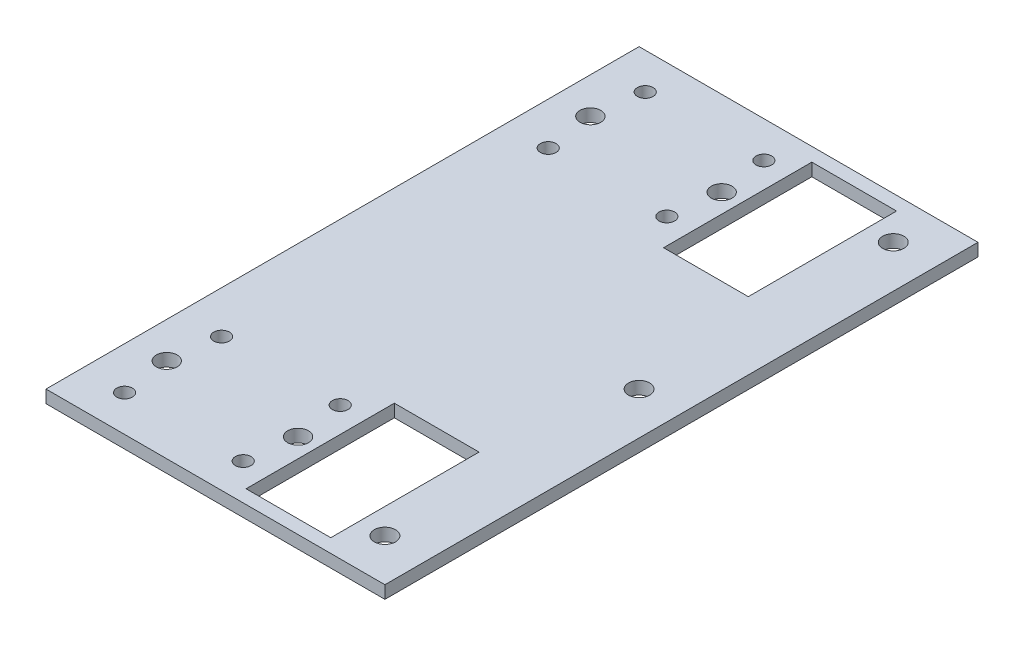
from build123d import *

# Parameters (mm, degrees)
SKETCH_1_R          = 2.5
SKETCH_1_R_2        = 2.45
SKETCH_1_R_3        = 1.85
SKETCH_1_W          = 48
SKETCH_1_H          = 40
EXTRUDE_1_DEPTH     = 3
SKETCH_2_W          = 20
SKETCH_2_H          = 35
CUT_EXTRUDE_1_DEPTH = 10


with BuildPart() as part:
    # 草图1 → 凸台-拉伸1 (new body)
    # profile 1 of 5: a face of its own
    with BuildSketch(Plane(origin=(0, 0, 0), x_dir=(1, 0, 0), z_dir=(0, 1, 0))):
        with BuildLine():
            Line((8, -30), (8, -70))
            Line((8, -70), (40, -70))
            Line((40, -70), (40, 60))
            Line((40, 60), (32.5, 60))
            ThreePointArc((32.5, 60), (28.232233047, 58.232233047), (30, 62.5))
            Line((30, 62.5), (30, 70))
            Line((30, 70), (8, 70))
            Line((8, 70), (8, 30))
            Line((8, 30), (-40, 30))
            Line((-40, 30), (-40, -30))
            Line((-40, -30), (8, -30))
        make_face()
        with Locations(Location((30, -60, 0), (0, 0, 270))):
            Circle(SKETCH_1_R, mode=Mode.SUBTRACT)
        with Locations(Location((30, 0, 0), (0, 0, 270))):
            Circle(SKETCH_1_R, mode=Mode.SUBTRACT)
    # profile 2 of 5: a face of its own
    with BuildSketch(Plane(origin=(0, 0, 0), x_dir=(1, 0, 0), z_dir=(0, 1, 0))):
        with BuildLine():
            Line((32.5, 60), (40, 60))
            Line((40, 60), (40, 70))
            Line((40, 70), (30, 70))
            Line((30, 70), (30, 62.5))
            ThreePointArc((30, 62.5), (31.767766953, 61.767766953), (32.5, 60))
        make_face()
    # profile 3 of 5: a face of its own
    with BuildSketch(Plane(origin=(0, 0, 0), x_dir=(1, 0, 0), z_dir=(0, 1, 0))):
        with BuildLine():
            Line((-40, 61.45), (-40, 30))
            Line((-40, 30), (8, 30))
            Line((8, 30), (8, 70))
            Line((8, 70), (-30, 70))
            Line((-30, 70), (-30, 63.3))
            ThreePointArc((-30, 63.3), (-28.691852455, 62.758147545), (-28.15, 61.45))
            ThreePointArc((-28.15, 61.45), (-30, 59.6), (-31.85, 61.45))
            Line((-31.85, 61.45), (-40, 61.45))
        make_face()
        with Locations(Location((-31.5, 50, 0), (0, 0, 270))):
            Circle(SKETCH_1_R_2, mode=Mode.SUBTRACT)
        with Locations(Location((-30, 38.55, 0), (0, 0, 270))):
            Circle(SKETCH_1_R_3, mode=Mode.SUBTRACT)
        with Locations(Location((-2, 38.55, 0), (0, 0, 270))):
            Circle(SKETCH_1_R_3, mode=Mode.SUBTRACT)
        with Locations(Location((-0.5, 50, 0), (0, 0, 270))):
            Circle(SKETCH_1_R_2, mode=Mode.SUBTRACT)
        with Locations(Location((-2, 61.45, 0), (0, 0, 270))):
            Circle(SKETCH_1_R_3, mode=Mode.SUBTRACT)
    # profile 4 of 5: a face of its own
    with BuildSketch(Plane(origin=(0, 0, 0), x_dir=(1, 0, 0), z_dir=(0, 1, 0))):
        with BuildLine():
            Line((-40, 70), (-40, 61.45))
            Line((-40, 61.45), (-31.85, 61.45))
            ThreePointArc((-31.85, 61.45), (-31.308147545, 62.758147545), (-30, 63.3))
            Line((-30, 63.3), (-30, 70))
            Line((-30, 70), (-40, 70))
        make_face()
    # profile 5 of 5: a face of its own
    with BuildSketch(Plane(origin=(0, 0, 0), x_dir=(1, 0, 0), z_dir=(0, 1, 0))):
        with Locations((-16, -50)):
            Rectangle(SKETCH_1_W, SKETCH_1_H)
        with Locations(Location((-30, -61.45, 0), (0, 0, 270))):
            Circle(SKETCH_1_R_3, mode=Mode.SUBTRACT)
        with Locations(Location((-31.5, -50, 0), (0, 0, 270))):
            Circle(SKETCH_1_R_2, mode=Mode.SUBTRACT)
        with Locations(Location((-30, -38.55, 0), (0, 0, 270))):
            Circle(SKETCH_1_R_3, mode=Mode.SUBTRACT)
        with Locations(Location((-2, -61.45, 0), (0, 0, 270))):
            Circle(SKETCH_1_R_3, mode=Mode.SUBTRACT)
        with Locations(Location((-0.5, -50, 0), (0, 0, 270))):
            Circle(SKETCH_1_R_2, mode=Mode.SUBTRACT)
        with Locations(Location((-2, -38.55, 0), (0, 0, 270))):
            Circle(SKETCH_1_R_3, mode=Mode.SUBTRACT)
    extrude(amount=EXTRUDE_1_DEPTH)

    # 草图2 → 切除-拉伸1 (cut)
    with BuildSketch(Plane(origin=(0, 3, 0), x_dir=(1, 0, 0), z_dir=(0, 1, 0))):
        with Locations((14, 49.275)):
            Rectangle(SKETCH_2_W, SKETCH_2_H)
        with Locations((14, -49.275)):
            Rectangle(SKETCH_2_W, SKETCH_2_H)
    extrude(amount=-CUT_EXTRUDE_1_DEPTH, mode=Mode.SUBTRACT)


solid = part.part
